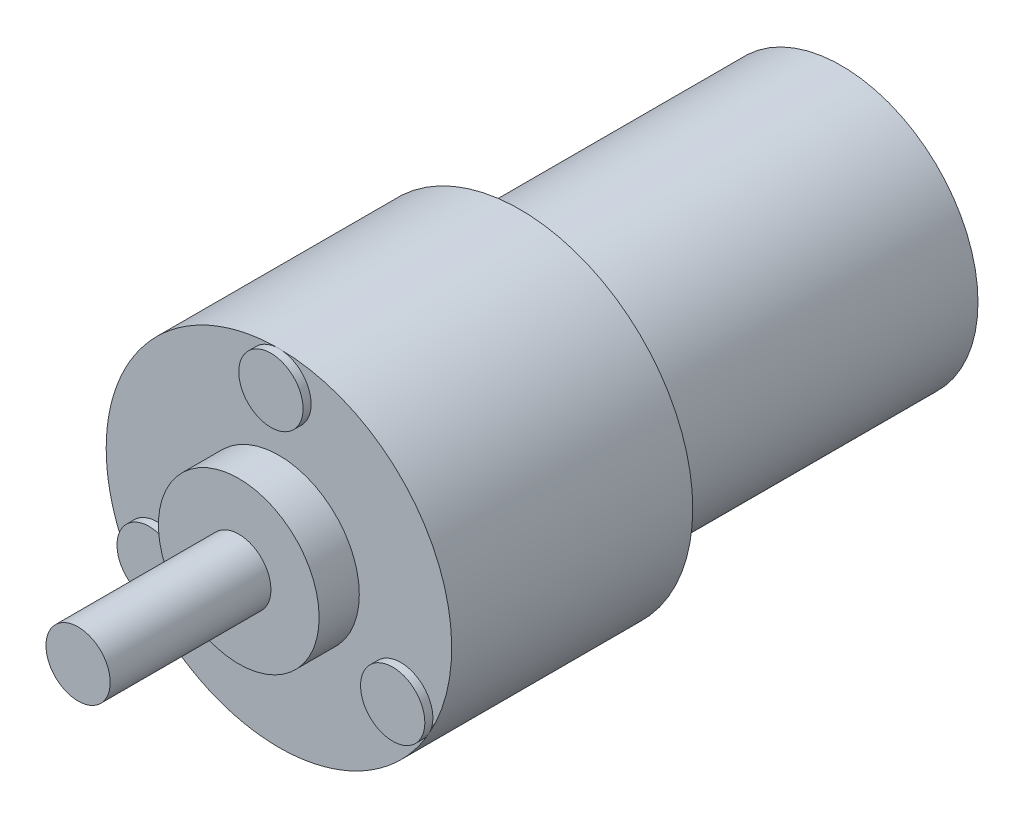
from build123d import *

# Parameters (mm, degrees)
ESQUISSE1_R      = 21.5
EXTRUSION1_DEPTH = 30
ESQUISSE2_R      = 10
EXTRUSION2_DEPTH = 5
ESQUISSE3_R      = 4
EXTRUSION3_DEPTH = 20
ESQUISSE4_R      = 17
EXTRUSION4_DEPTH = 40
ESQUISSE5_R      = 4
EXTRUSION5_DEPTH = 1


with BuildPart() as part:
    # Esquisse1 → Extrusion1 (new body)
    with BuildSketch(Plane.XY):
        Circle(ESQUISSE1_R)
    extrude(amount=EXTRUSION1_DEPTH)

    # Esquisse2 → Extrusion2 (add)
    with BuildSketch(Plane.XY.offset(30)):
        Circle(ESQUISSE2_R)
    extrude(amount=EXTRUSION2_DEPTH)

    # Esquisse3 → Extrusion3 (add)
    with BuildSketch(Plane.XY.offset(35)):
        Circle(ESQUISSE3_R)
    extrude(amount=EXTRUSION3_DEPTH)

    # Esquisse4 → Extrusion4 (add)
    with BuildSketch(Plane(origin=(0, 0, 0), x_dir=(-1, 0, 0), z_dir=(0, 0, -1))):
        with Locations(Location((0, 0, 0), (0, 0, 180))):
            Circle(ESQUISSE4_R)
    extrude(amount=EXTRUSION4_DEPTH)

    # Esquisse5 → Extrusion5 (add)
    with BuildSketch(Plane.XY.offset(30)):
        with Locations(Location((0, 17.5, 0), (0, 0, 89.999550935))):
            Circle(ESQUISSE5_R)
        with Locations(Location((-15.155444566, -8.75, 0), (0, 0, 209.999550935))):
            Circle(ESQUISSE5_R)
        with Locations(Location((15.155444566, -8.75, 0), (0, 0, 329.999550935))):
            Circle(ESQUISSE5_R)
    extrude(amount=EXTRUSION5_DEPTH)


solid = part.part
